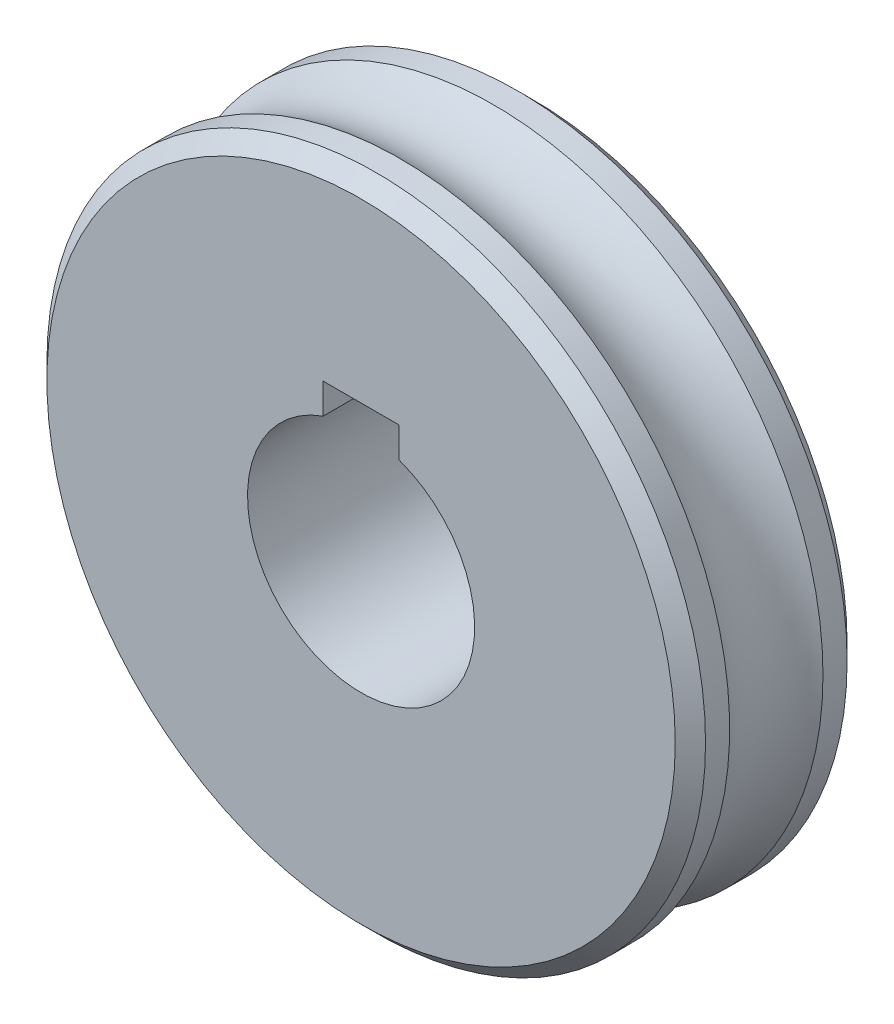
from build123d import *

# Parameters (mm, degrees)
SKETCH1_R           = 43.5
BOSS_EXTRUDE1_DEPTH = 11.35
CHAMFER1_SIZE       = 2
SKETCH2_R           = 10.5


with BuildPart() as part:
    # Sketch1 → Boss-Extrude1 (new, symmetric)
    with BuildSketch(Plane.XY):
        Circle(SKETCH1_R)
        with BuildLine():
            Line((-5, 18.142135624), (5, 18.142135624))
            Line((5, 18.142135624), (5, 14.142135624))
            ThreePointArc((5, 14.142135624), (0, -15), (-5, 14.142135624))
            Line((-5, 14.142135624), (-5, 18.142135624))
        make_face(mode=Mode.SUBTRACT)
    extrude(amount=BOSS_EXTRUDE1_DEPTH, both=True)

    # Chamfer1
    chamfer1_edges = [part.edges().sort_by_distance(p)[0] for p in [
        (-43.5, 0, -11.35),
        (-43.5, 0, 11.35),
    ]]
    chamfer(chamfer1_edges, length=CHAMFER1_SIZE)

    # Sketch2 → Cut-Revolve1 (revolve, cut)
    with BuildSketch(Plane(origin=(0, 0, 0), x_dir=(0, 0, -1), z_dir=(1, 0, 0)), mode=Mode.PRIVATE) as cut_revolve1_sk:
        with Locations((0, -52)):
            Circle(SKETCH2_R)
    revolve(cut_revolve1_sk.sketch.rotate(Axis((0, 0, -83.533331893), (0, 0, 1)), 270), axis=Axis((0, 0, -83.533331893), (0, 0, 1)), mode=Mode.SUBTRACT)


solid = part.part
